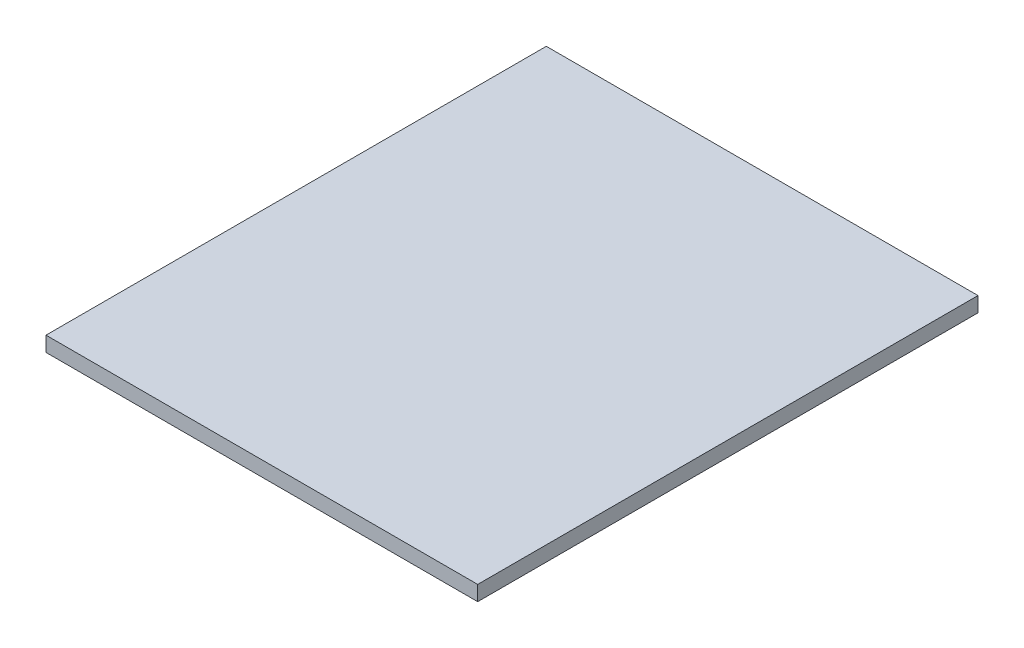
from build123d import *

# Parameters (mm, degrees)
SKETCH2_W           = 40.67556
SKETCH2_H           = 47.13986
BOSS_EXTRUDE1_DEPTH = 1.41224


with BuildPart() as part:
    # Sketch2 → Boss-Extrude1 (new body)
    with BuildSketch(Plane(origin=(0, 0, 0), x_dir=(1, 0, 0), z_dir=(0, 1, 0))):
        with Locations((20.33778, 23.56993)):
            Rectangle(SKETCH2_W, SKETCH2_H)
    extrude(amount=BOSS_EXTRUDE1_DEPTH)


solid = part.part
